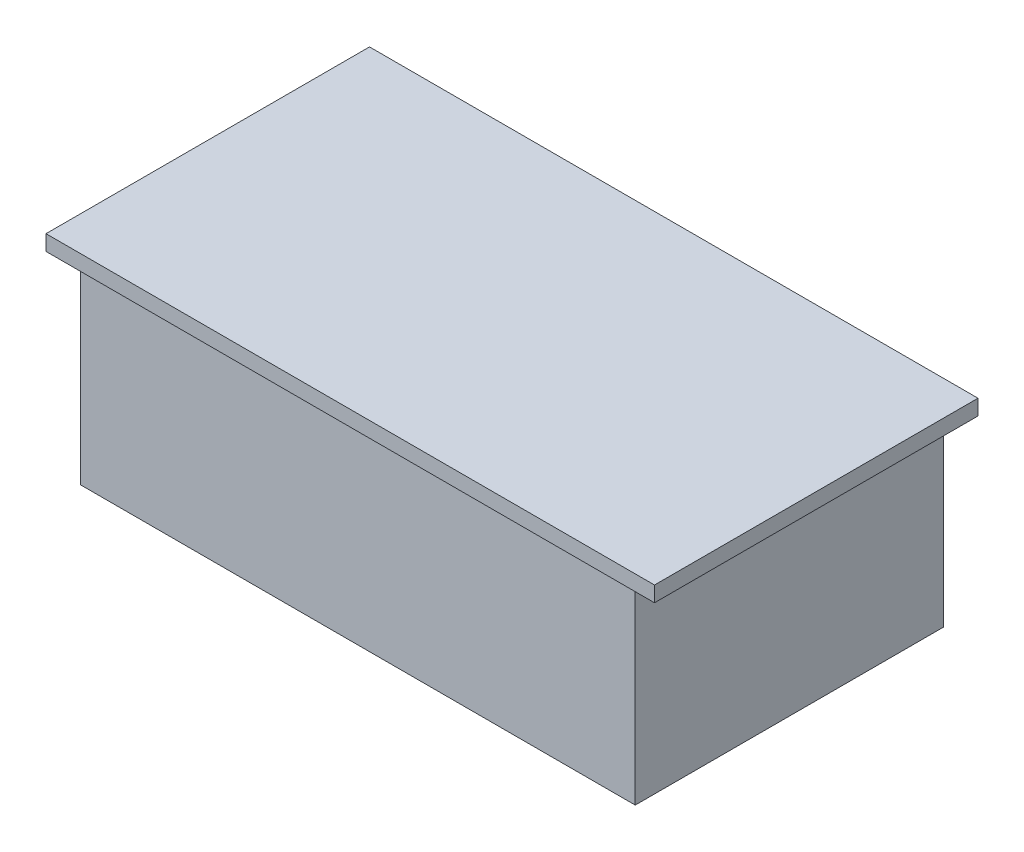
from build123d import *

# Parameters (mm, degrees)
SKETCH_1_W      = 72
SKETCH_1_H      = 40
EXTRUDE_1_DEPTH = 25
EXTRUDE_START   = 25
SKETCH_1_4_W    = 79
SKETCH_1_4_H    = 42
EXTRUDE_3_DEPTH = 2


with BuildPart() as part:
    # 草图1 → 凸台-拉伸1 (new body)
    with BuildSketch(Plane(origin=(0, 0, 0), x_dir=(1, 0, 0), z_dir=(0, 1, 0))):
        Rectangle(SKETCH_1_W, SKETCH_1_H)
    extrude(amount=EXTRUDE_1_DEPTH)


with BuildPart() as body_2:
    # 草图1<4> → 凸台-拉伸3 (new body)
    with BuildSketch(Plane(origin=(0, 0, 0), x_dir=(1, 0, 0), z_dir=(0, 1, 0)).offset(EXTRUDE_START)):
        Rectangle(SKETCH_1_4_W, SKETCH_1_4_H)
    extrude(amount=EXTRUDE_3_DEPTH)


solid = Compound([part.part, body_2.part])
